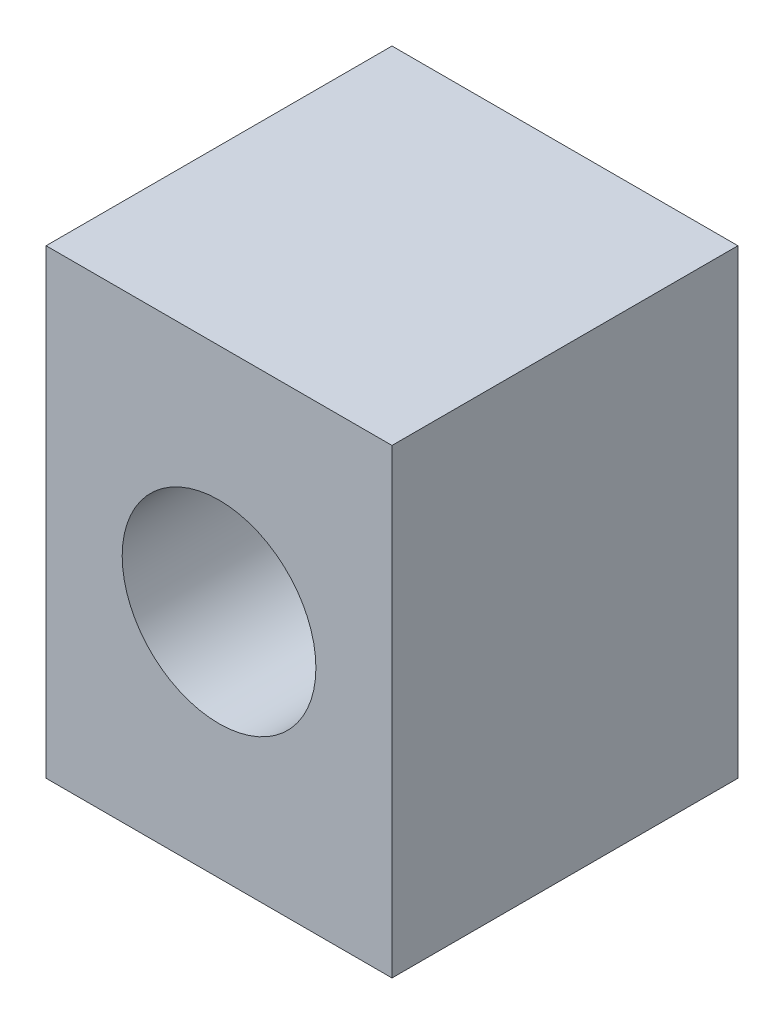
from build123d import *

# Parameters (mm, degrees)
SKETCH1_W           = 38.1
SKETCH1_H           = 50.8
SKETCH1_R           = 10.668
BOSS_EXTRUDE1_DEPTH = 38.1


with BuildPart() as part:
    # Sketch1 → Boss-Extrude1 (new body)
    with BuildSketch(Plane.XY):
        Rectangle(SKETCH1_W, SKETCH1_H)
        with Locations(Location((0, 0, 0), (0, 0, 180))):
            Circle(SKETCH1_R, mode=Mode.SUBTRACT)
    extrude(amount=BOSS_EXTRUDE1_DEPTH)


solid = part.part
